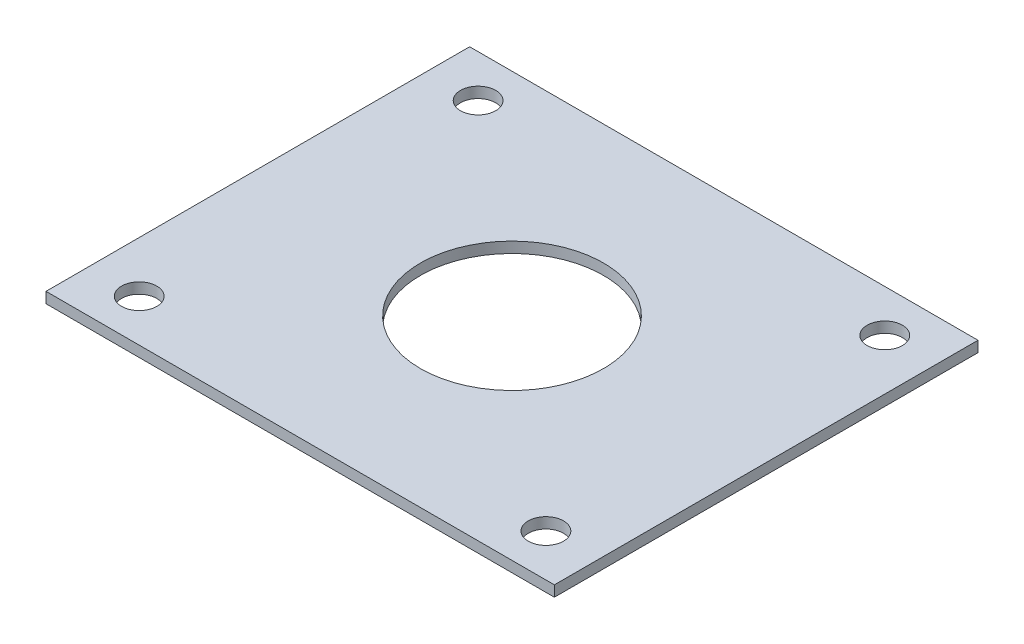
from build123d import *

# Parameters (mm, degrees)
BOSS_EXTRUDE1_DEPTH      = 0.79375
BOSS_EXTRUDE1_DEPTH_BACK = 0.79375
SKETCH1_W                = 75
SKETCH1_H                = 62.5
SKETCH1_R                = 13.5
SKETCH1_R_2              = 2.6


with BuildPart() as part:
    # Sketch1 → Boss-Extrude1 (new, two sides: drawn at the far end of the back side and taken through both)
    with BuildSketch(Plane(origin=(0, 0, 0), x_dir=(1, 0, 0), z_dir=(0, 1, 0)).offset(-BOSS_EXTRUDE1_DEPTH_BACK)):
        Rectangle(SKETCH1_W, SKETCH1_H)
        Circle(SKETCH1_R, mode=Mode.SUBTRACT)
        with Locations((30, 25)):
            Circle(SKETCH1_R_2, mode=Mode.SUBTRACT)
        with Locations((-30, 25)):
            Circle(SKETCH1_R_2, mode=Mode.SUBTRACT)
        with Locations((30, -25)):
            Circle(SKETCH1_R_2, mode=Mode.SUBTRACT)
        with Locations((-30, -25)):
            Circle(SKETCH1_R_2, mode=Mode.SUBTRACT)
    extrude(amount=BOSS_EXTRUDE1_DEPTH + BOSS_EXTRUDE1_DEPTH_BACK)


solid = part.part
